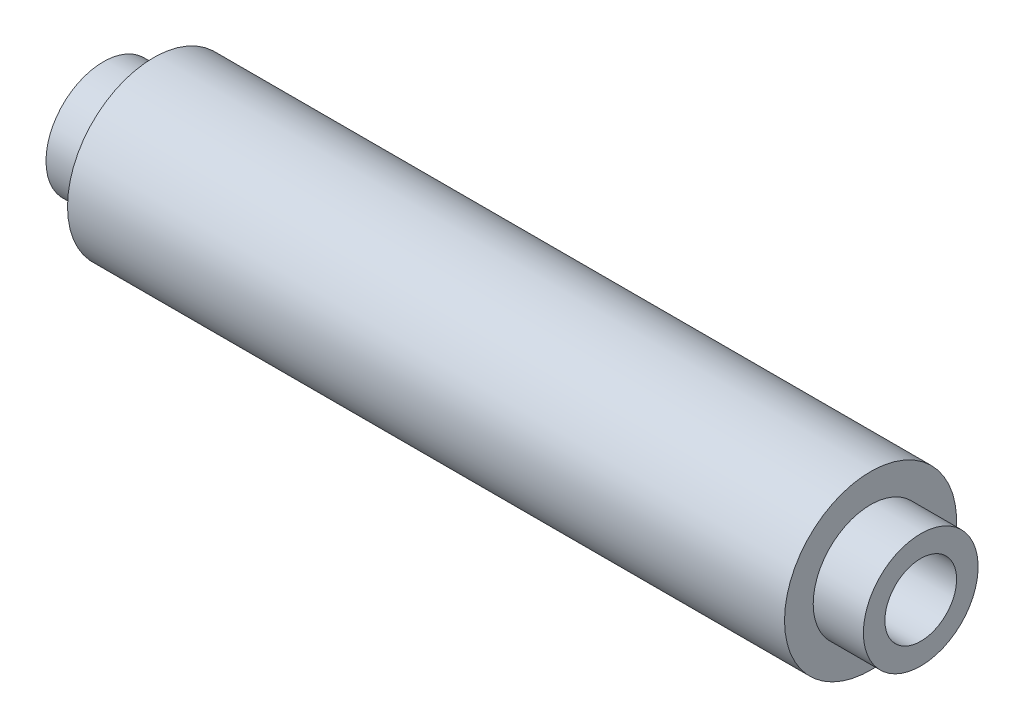
from build123d import *


with BuildPart() as part:
    # Sketch1 → Revolve1 (revolve)
    with BuildSketch(Plane.XY, mode=Mode.PRIVATE) as revolve1_sk:
        Polygon((0, 2.5), (20, 2.5), (20, 0), (37, 0), (37, 2.5), (57, 2.5), (57, 4), (53.5, 4), (53.5, 6), (3.5, 6), (3.5, 4), (0, 4), align=None)
    revolve(revolve1_sk.sketch.rotate(Axis((0, 0, 0), (1, 0, 0)), 90), axis=Axis((0, 0, 0), (1, 0, 0)))


solid = part.part
